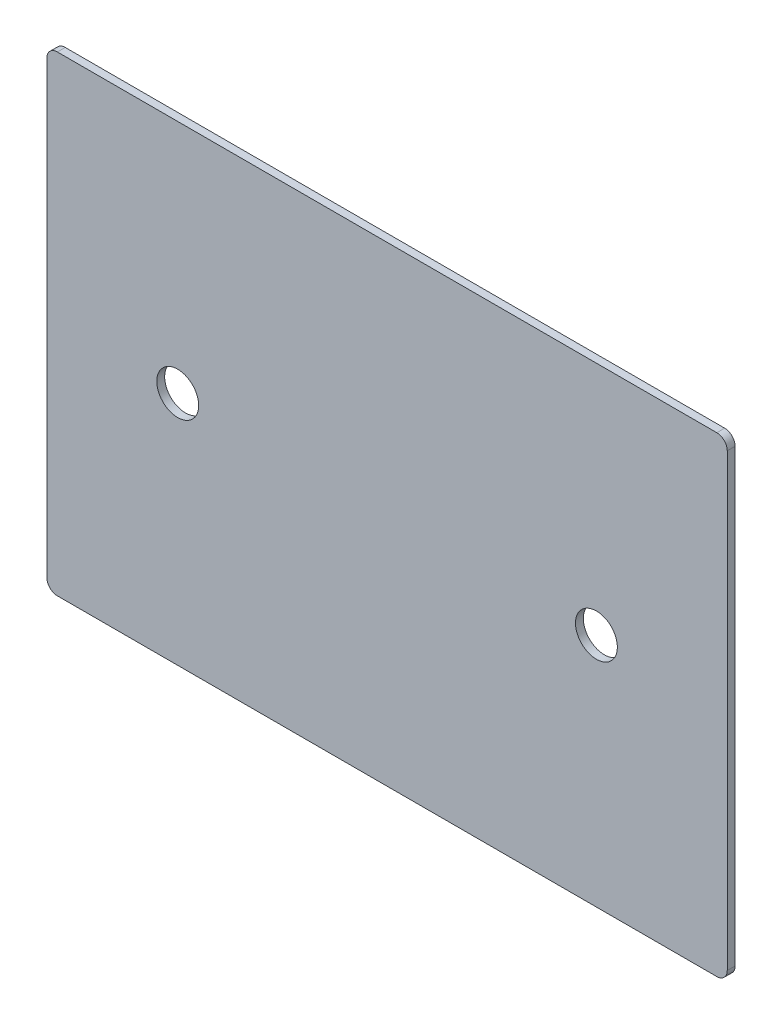
from build123d import *

# Parameters (mm, degrees)
SKETCH_1_W          = 130
SKETCH_1_H          = 90
EXTRUDE_1_DEPTH     = 1.5
SKETCH_2_R          = 4
CUT_EXTRUDE_1_DEPTH = 1.5
FILLET_1_R          = 2


with BuildPart() as part:
    # ｽｹｯﾁ1 → ﾎﾞｽ - 押し出し1 (new body)
    with BuildSketch(Plane.XY):
        Rectangle(SKETCH_1_W, SKETCH_1_H)
    extrude(amount=EXTRUDE_1_DEPTH)

    # ｽｹｯﾁ2 → ｶｯﾄ - 押し出し1 (cut)
    with BuildSketch(Plane.XY.offset(1.5)):
        with Locations((-40, 0)):
            Circle(SKETCH_2_R)
        with Locations(Location((40, 0, 0), (0, 0, 180))):
            Circle(SKETCH_2_R)
    extrude(amount=-CUT_EXTRUDE_1_DEPTH, mode=Mode.SUBTRACT)

    # ﾌｨﾚｯﾄ1
    fillet_1_edges = [part.edges().sort_by_distance(p)[0] for p in [
        (65, -45, 0.75),
        (-65, -45, 0.75),
        (-65, 45, 0.75),
        (65, 45, 0.75),
    ]]
    fillet(fillet_1_edges, radius=FILLET_1_R)


solid = part.part
